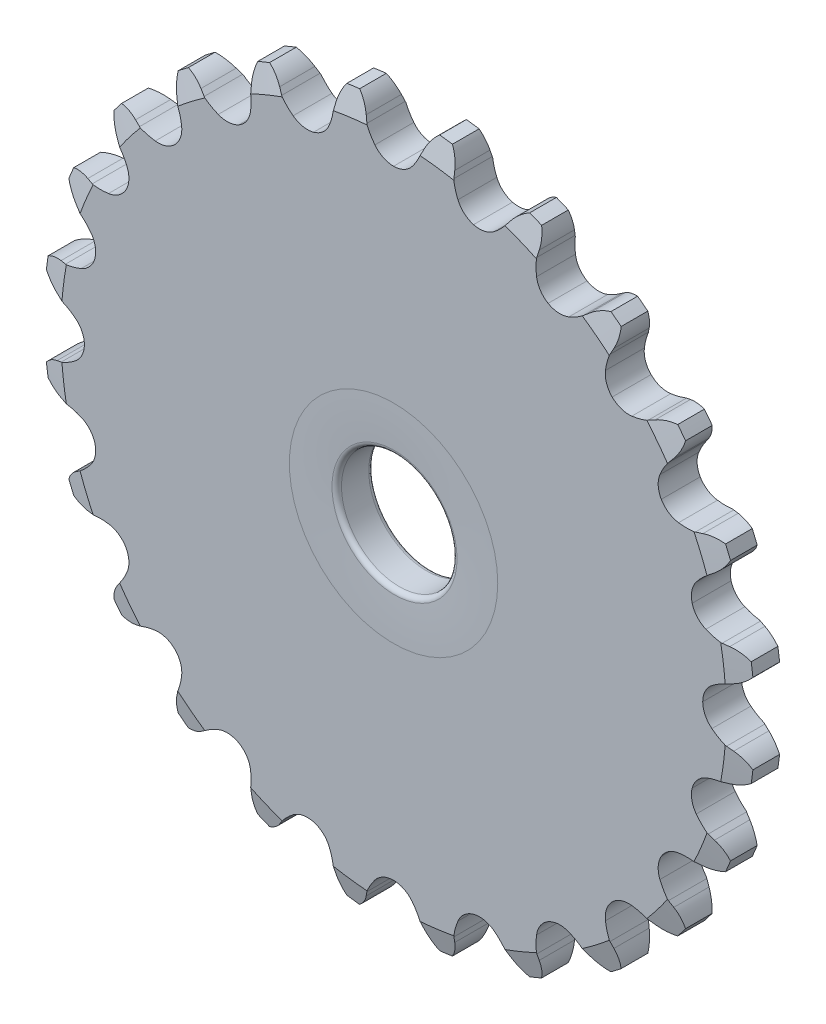
from build123d import *

# Parameters (mm, degrees)
CUT_EXTRUDE1_DEPTH      = 56.180037073
CIRPATTERN1_COUNT       = 24
SKETCH5_OUTSIDE_W       = 519.062
SKETCH5_OUTSIDE_H       = 519.062
SKETCH5_OUTSIDE_R       = 36.486929704
CUT_EXTRUDE2_DEPTH      = 55.954147078
CUT_EXTRUDE2_DRAFT      = -75
MIRROR1_COPY_1_SKETCH_W = 519.062
MIRROR1_COPY_1_SKETCH_H = 519.062
MIRROR1_COPY_1_SKETCH_R = 36.486929704
MIRROR1_COPY_1_DEPTH    = 55.954147078
MIRROR1_COPY_1_DRAFT    = -75


with BuildPart() as part:
    # Sketch3 → Revolve1 (revolve)
    with BuildSketch(Plane(origin=(0, 0, 0), x_dir=(0, 0, -1), z_dir=(1, 0, 0)), mode=Mode.PRIVATE) as revolve1_sk:
        with BuildLine():
            Line((-2.1336, 38.989), (2.1336, 38.989))
            Line((2.1336, 38.989), (2.1336, 11.43))
            ThreePointArc((2.1336, 11.43), (2.10692637, 9.143637077), (2.02692, 6.858518725))
            ThreePointArc((2.02692, 6.858518725), (1.862369476, 6.497532645), (1.494100629, 6.35))
            Line((1.494100629, 6.35), (-1.494100629, 6.35))
            ThreePointArc((-1.494100629, 6.35), (-1.862369476, 6.497532645), (-2.02692, 6.858518725))
            ThreePointArc((-2.02692, 6.858518725), (-2.10692637, 9.143637077), (-2.1336, 11.43))
            Line((-2.1336, 11.43), (-2.1336, 38.989))
        make_face()
    revolve(revolve1_sk.sketch.rotate(Axis((0, 0, 2.1336), (0, 0, -1)), 90), axis=Axis((0, 0, 2.1336), (0, 0, -1)))

    # Sketch4 → Cut-Extrude1 (cut, symmetric)
    with BuildSketch(Plane.XY):
        with BuildLine():
            Line((6.590631393, 36.007094226), (6.511720136, 36.665605176))
            ThreePointArc((6.511720136, 36.665605176), (6.07508152, 38.082563868), (5.168084786, 39.255501267))
            ThreePointArc((5.168084786, 39.255501267), (10.700770083, 39.935817629), (15.15205792, 36.580303729))
            ThreePointArc((15.15205792, 36.580303729), (13.780107008, 36.018008511), (12.693487528, 35.009205595))
            Line((12.693487528, 35.009205595), (12.2958929, 34.478374013))
            ThreePointArc((12.2958929, 34.478374013), (11.698630015, 33.793990359), (11.013733272, 33.197315917))
            ThreePointArc((11.013733272, 33.197315917), (9.946003454, 32.717474122), (8.775922224, 32.752187624))
            ThreePointArc((8.775922224, 32.752187624), (7.745245404, 33.307165465), (7.060485155, 34.256585558))
            ThreePointArc((7.060485155, 34.256585558), (6.765684397, 35.115769154), (6.590631393, 36.007094226))
        make_face()
    cut_extrude1 = extrude(amount=CUT_EXTRUDE1_DEPTH, both=True, mode=Mode.SUBTRACT)

    # CirPattern1: Cut-Extrude1 ×24 about axis
    cirpattern1_axis = Axis((0, 0, 0), (0, 0, 1))
    for i in range(1, CIRPATTERN1_COUNT):
        add(cut_extrude1.rotate(cirpattern1_axis, i * 360 / CIRPATTERN1_COUNT), mode=Mode.SUBTRACT)


with BuildPart() as cut_extrude2_tool:
    # Sketch5 outside → Cut-Extrude2 (with draft: the straight prism first)
    with BuildSketch(Plane.XY.offset(2.1336)):
        Rectangle(SKETCH5_OUTSIDE_W, SKETCH5_OUTSIDE_H)
        Circle(SKETCH5_OUTSIDE_R, mode=Mode.SUBTRACT)
    extrude(amount=-CUT_EXTRUDE2_DEPTH)
    # Cut-Extrude2: the draft: its side faces are tilted about the plane it starts from
    cut_extrude2_sides = [cut_extrude2_tool.faces().sort_by_distance(p)[0] for p in [
        (0, -259.531, -25.843473539),
        (259.531, 0, -25.843473539),
        (0, 259.531, -25.843473539),
        (-259.531, 0, -25.843473539),
        (-36.486929704, 0, -25.843473539),
    ]]
    draft(cut_extrude2_sides, Plane.XY.offset(2.1336), CUT_EXTRUDE2_DRAFT)


with BuildPart() as part_1:
    add(part.part)

    # Cut-Extrude2: cut by cut_extrude2_tool
    add(cut_extrude2_tool.part, mode=Mode.SUBTRACT)


with BuildPart() as mirror1_copy_1_tool:
    # Mirror1 copy 1 sketch → Mirror1 copy 1 (with draft: the straight prism first)
    with BuildSketch(Plane(origin=(0, 0, -2.1336), x_dir=(1, 0, 0), z_dir=(0, 0, -1))):
        Rectangle(MIRROR1_COPY_1_SKETCH_W, MIRROR1_COPY_1_SKETCH_H)
        Circle(MIRROR1_COPY_1_SKETCH_R, mode=Mode.SUBTRACT)
    extrude(amount=-MIRROR1_COPY_1_DEPTH)
    # Mirror1 copy 1: the draft: its side faces are tilted about the plane it starts from
    mirror1_copy_1_sides = [mirror1_copy_1_tool.faces().sort_by_distance(p)[0] for p in [
        (0, -259.531, 25.843473539),
        (259.531, 0, 25.843473539),
        (0, 259.531, 25.843473539),
        (-259.531, 0, 25.843473539),
        (-36.486929704, 0, 25.843473539),
    ]]
    draft(mirror1_copy_1_sides, Plane(origin=(0, 0, -2.1336), x_dir=(1, 0, 0), z_dir=(0, 0, -1)), MIRROR1_COPY_1_DRAFT)


with BuildPart() as part_2:
    add(part_1.part)

    # Mirror1 copy 1: cut by mirror1_copy_1_tool
    add(mirror1_copy_1_tool.part, mode=Mode.SUBTRACT)


solid = part_2.part
